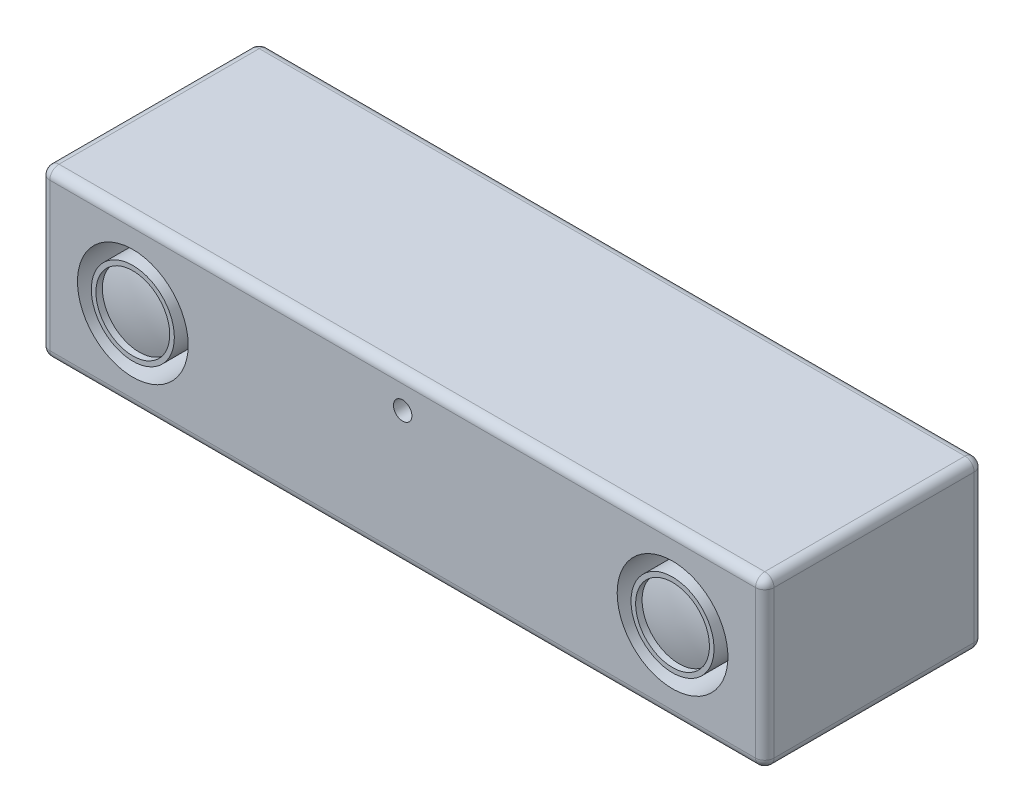
from build123d import *

# Parameters (mm, degrees)
SKETCH_1_W          = 157
SKETCH_1_H          = 47.4
EXTRUDE_1_DEPTH     = 36
FILLET_1_R          = 2
SKETCH_2_R          = 2
SKETCH_2_R_2        = 12
SKETCH_2_R_3        = 9
CUT_EXTRUDE_1_DEPTH = 20


with BuildPart() as part:
    # 草图1 → 凸台-拉伸1 (new body)
    with BuildSketch(Plane(origin=(0, 0, 0), x_dir=(1, 0, 0), z_dir=(0, 1, 0))):
        Rectangle(SKETCH_1_W, SKETCH_1_H)
    extrude(amount=EXTRUDE_1_DEPTH)

    # 圆角1
    fillet_1_edges = [part.edges().sort_by_distance(p)[0] for p in [
        (-78.5, 36, 0),
        (0, 36, 23.7),
        (78.5, 36, 0),
        (0, 0, 23.7),
        (-78.5, 0, 0),
        (0, 0, -23.7),
        (78.5, 0, 0),
        (78.5, 18, 23.7),
        (-78.5, 18, 23.7),
        (-78.5, 18, -23.7),
        (78.5, 18, -23.7),
        (0, 36, -23.7),
    ]]
    fillet(fillet_1_edges, radius=FILLET_1_R)

    # 草图2 → 切除-拉伸1 (cut)
    # profile 1 of 3: a face of its own
    with BuildSketch(Plane.XY.offset(23.7)):
        with Locations((0, 29)):
            Circle(SKETCH_2_R)
    # profile 2 of 3: a face of its own
    with BuildSketch(Plane.XY.offset(23.7)):
        with Locations((-58.5, 18)):
            Circle(SKETCH_2_R_2)
        with Locations((-58.5, 18)):
            Circle(SKETCH_2_R_3, mode=Mode.SUBTRACT)
    # profile 3 of 3: a face of its own
    with BuildSketch(Plane.XY.offset(23.7)):
        with Locations(Location((58.5, 18, 0), (0, 0, 180))):
            Circle(SKETCH_2_R_2)
        with Locations(Location((58.5, 18, 0), (0, 0, 180))):
            Circle(SKETCH_2_R_3, mode=Mode.SUBTRACT)
    extrude(amount=-CUT_EXTRUDE_1_DEPTH, mode=Mode.SUBTRACT)

    # 草图4 → 切除-旋转1 (revolve, cut)
    with BuildSketch(Plane(origin=(-58.5, 0, 0), x_dir=(0, -1, 0), z_dir=(-1, 0, 0)), mode=Mode.PRIVATE) as cut_revolve_1_sk:
        with BuildLine():
            Line((-18, 23.7), (-26, 23.7))
            Line((-26, 23.7), (-26, 22.302272637))
            ThreePointArc((-26, 22.302272637), (-22.037480816, 23.124288414), (-18, 23.4))
            Line((-18, 23.4), (-18, 23.7))
        make_face()
    cut_revolve_1 = revolve(cut_revolve_1_sk.sketch.rotate(Axis((-58.5, 18, 23.230858861), (0, 0, -1)), 180), axis=Axis((-58.5, 18, 23.230858861), (0, 0, -1)), mode=Mode.SUBTRACT)

    # 镜向1: 切除-旋转1 across plane
    add(cut_revolve_1.mirror(Plane(origin=(0, 0, 0), x_dir=(0, 0, 1), z_dir=(1, 0, 0))), mode=Mode.SUBTRACT)


solid = part.part
